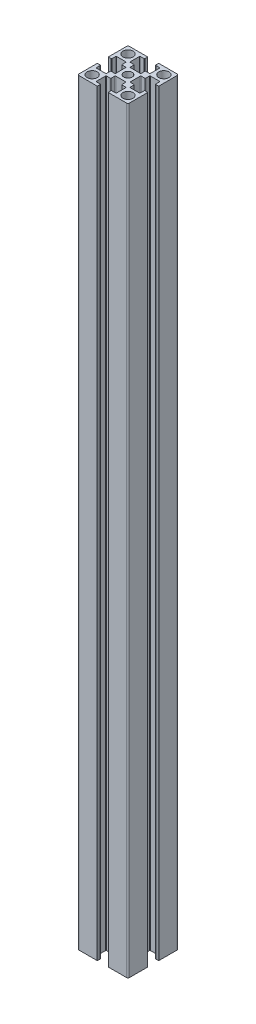
from build123d import *

# Parameters (mm, degrees)
SKETCH_1_R      = 2
SKETCH_1_R_2    = 1.65
EXTRUDE_1_DEPTH = 300
FILLET_1_R      = 0.2


with BuildPart() as part:
    # 草图1 → 凸台-拉伸1 (new body)
    with BuildSketch(Plane(origin=(0, 0, 0), x_dir=(1, 0, 0), z_dir=(0, 1, 0))):
        with BuildLine():
            Line((-9.5, 10), (-2.15, 10))
            Line((-2.15, 10), (-2.15, 8.7))
            Line((-2.15, 8.7), (-4, 8.7))
            Line((-4, 8.7), (-4, 4.7))
            Line((-4, 4.7), (-2.15, 4.7))
            Line((-2.15, 4.7), (-2.15, 2.9))
            Line((-2.15, 2.9), (0, 2.9))
            Line((0, 2.9), (2.15, 2.9))
            Line((2.15, 2.9), (2.15, 4.7))
            Line((2.15, 4.7), (4, 4.7))
            Line((4, 4.7), (4, 8.7))
            Line((4, 8.7), (2.15, 8.7))
            Line((2.15, 8.7), (2.15, 10))
            Line((2.15, 10), (9.5, 10))
            ThreePointArc((9.5, 10), (9.853553391, 9.853553391), (10, 9.5))
            Line((10, 9.5), (10, 2.15))
            Line((10, 2.15), (8.7, 2.15))
            Line((8.7, 2.15), (8.7, 4))
            Line((8.7, 4), (4.7, 4))
            Line((4.7, 4), (4.7, 2.15))
            Line((4.7, 2.15), (2.9, 2.15))
            Line((2.9, 2.15), (2.9, 0))
            Line((2.9, 0), (2.9, -2.15))
            Line((2.9, -2.15), (4.7, -2.15))
            Line((4.7, -2.15), (4.7, -4))
            Line((4.7, -4), (8.7, -4))
            Line((8.7, -4), (8.7, -2.15))
            Line((8.7, -2.15), (10, -2.15))
            Line((10, -2.15), (10, -9.5))
            ThreePointArc((10, -9.5), (9.853553391, -9.853553391), (9.5, -10))
            Line((9.5, -10), (2.15, -10))
            Line((2.15, -10), (2.15, -8.7))
            Line((2.15, -8.7), (4, -8.7))
            Line((4, -8.7), (4, -4.7))
            Line((4, -4.7), (2.15, -4.7))
            Line((2.15, -4.7), (2.15, -2.9))
            Line((2.15, -2.9), (0, -2.9))
            Line((0, -2.9), (-2.15, -2.9))
            Line((-2.15, -2.9), (-2.15, -4.7))
            Line((-2.15, -4.7), (-4, -4.7))
            Line((-4, -4.7), (-4, -8.7))
            Line((-4, -8.7), (-2.15, -8.7))
            Line((-2.15, -8.7), (-2.15, -10))
            Line((-2.15, -10), (-9.5, -10))
            ThreePointArc((-9.5, -10), (-9.853553391, -9.853553391), (-10, -9.5))
            Line((-10, -9.5), (-10, -2.15))
            Line((-10, -2.15), (-8.7, -2.15))
            Line((-8.7, -2.15), (-8.7, -4))
            Line((-8.7, -4), (-4.7, -4))
            Line((-4.7, -4), (-4.7, -2.15))
            Line((-4.7, -2.15), (-2.9, -2.15))
            Line((-2.9, -2.15), (-2.9, 0))
            Line((-2.9, 0), (-2.9, 2.15))
            Line((-2.9, 2.15), (-4.7, 2.15))
            Line((-4.7, 2.15), (-4.7, 4))
            Line((-4.7, 4), (-8.7, 4))
            Line((-8.7, 4), (-8.7, 2.15))
            Line((-8.7, 2.15), (-10, 2.15))
            Line((-10, 2.15), (-10, 9.5))
            ThreePointArc((-10, 9.5), (-9.853553391, 9.853553391), (-9.5, 10))
        make_face()
        with Locations(Location((-7.1, 7.1, 0), (0, 0, 270))):
            Circle(SKETCH_1_R, mode=Mode.SUBTRACT)
        with Locations(Location((7.1, 7.1, 0), (0, 0, 270))):
            Circle(SKETCH_1_R, mode=Mode.SUBTRACT)
        with Locations(Location((7.1, -7.1, 0), (0, 0, 270))):
            Circle(SKETCH_1_R, mode=Mode.SUBTRACT)
        with Locations(Location((-7.1, -7.1, 0), (0, 0, 270))):
            Circle(SKETCH_1_R, mode=Mode.SUBTRACT)
        with Locations(Location((0, 0, 0), (0, 0, 270))):
            Circle(SKETCH_1_R_2, mode=Mode.SUBTRACT)
    extrude(amount=EXTRUDE_1_DEPTH)

    # 圆角1
    fillet_1_edges = [part.edges().sort_by_distance(p)[0] for p in [
        (8.7, 150, 2.15),
        (10, 150, 2.15),
        (2.15, 150, 10),
        (2.15, 150, 8.7),
        (4, 150, 8.7),
        (4, 150, 4.7),
        (2.15, 150, 4.7),
        (2.15, 150, 2.9),
        (-2.15, 150, 2.9),
        (-2.15, 150, 4.7),
        (-4, 150, 4.7),
        (-4, 150, 8.7),
        (-2.15, 150, 8.7),
        (-2.15, 150, 10),
        (-10, 150, 2.15),
        (-8.7, 150, 2.15),
        (-8.7, 150, 4),
        (-4.7, 150, 4),
        (-4.7, 150, 2.15),
        (-2.9, 150, 2.15),
        (-2.9, 150, -2.15),
        (-4.7, 150, -2.15),
        (-4.7, 150, -4),
        (-8.7, 150, -4),
        (-8.7, 150, -2.15),
        (-10, 150, -2.15),
        (-2.15, 150, -10),
        (-2.15, 150, -8.7),
        (-4, 150, -8.7),
        (-4, 150, -4.7),
        (-2.15, 150, -4.7),
        (-2.15, 150, -2.9),
        (2.15, 150, -2.9),
        (2.15, 150, -4.7),
        (4, 150, -4.7),
        (4, 150, -8.7),
        (2.15, 150, -8.7),
        (2.15, 150, -10),
        (10, 150, -2.15),
        (8.7, 150, -2.15),
        (8.7, 150, -4),
        (4.7, 150, -4),
        (4.7, 150, -2.15),
        (2.9, 150, -2.15),
        (2.9, 150, 2.15),
        (4.7, 150, 2.15),
        (4.7, 150, 4),
        (8.7, 150, 4),
    ]]
    fillet(fillet_1_edges, radius=FILLET_1_R)


solid = part.part
